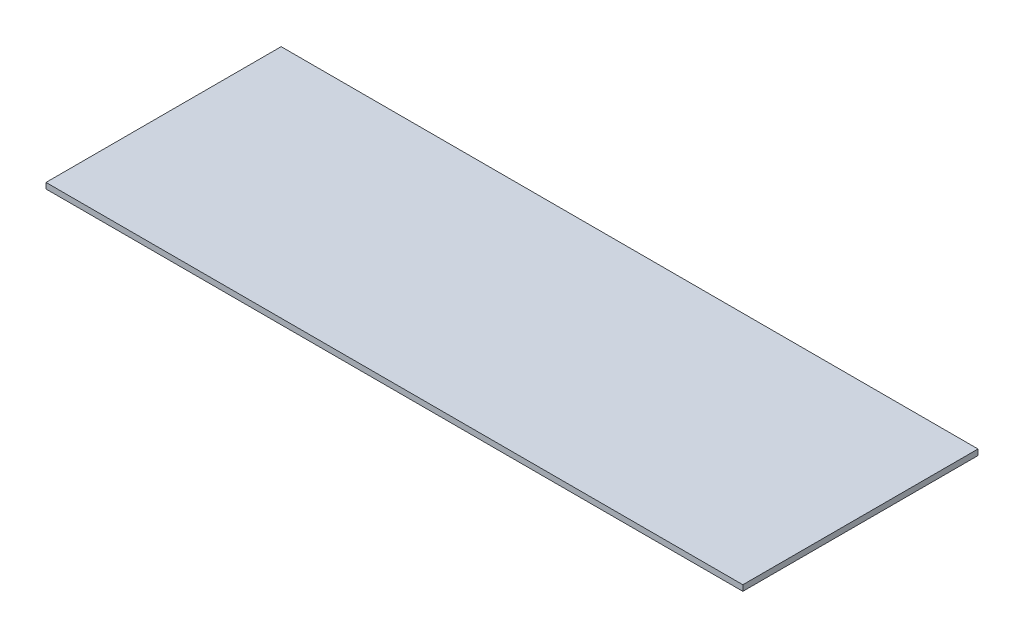
from build123d import *

# Parameters (mm, degrees)
SKETCH_1_W      = 6075
SKETCH_1_H      = 2050
EXTRUDE_1_DEPTH = 50


with BuildPart() as part:
    # 草图1 → 凸台-拉伸1 (new body)
    with BuildSketch(Plane(origin=(0, 0, 0), x_dir=(1, 0, 0), z_dir=(0, 1, 0))):
        Rectangle(SKETCH_1_W, SKETCH_1_H)
    extrude(amount=EXTRUDE_1_DEPTH)


solid = part.part
